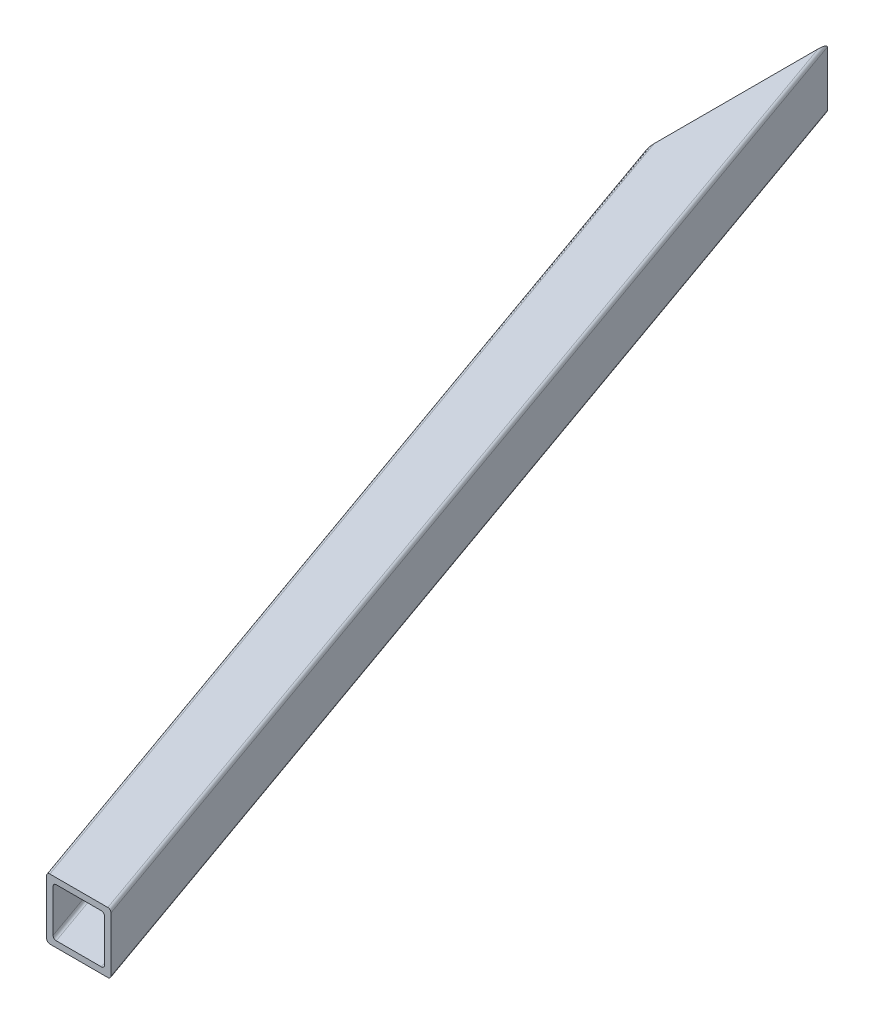
from build123d import *

# Parameters (mm, degrees)
BOSS_EXTRU_1_DEPTH           = 40
COQUE1_T                     = 4
ENL_V_MAT_EXTRU_1_DEPTH      = 833.320761278
ENL_V_MAT_EXTRU_1_DEPTH_BACK = 833.320761278
ESQUISSE2_W                  = 32
ESQUISSE2_H                  = 32
CONG_1_R                     = 2


with BuildPart() as part:
    # Esquisse1 → Boss.-Extru.1 (new body)
    with BuildSketch(Plane(origin=(0, 0, 0), x_dir=(1, 0, 0), z_dir=(0, 1, 0))):
        Polygon((0, 609.961146446), (215.575309292, 0), (258, 0), (0, 730), align=None)
    extrude(amount=BOSS_EXTRU_1_DEPTH)

    # Coque1 (no face opened: a closed hollow body)
    add(offset(amount=-COQUE1_T, mode=Mode.PRIVATE), mode=Mode.SUBTRACT)

    # Esquisse2 → Enlèv. mat.-Extru.1 (cut, two sides: drawn at the far end of the back side and taken through both)
    with BuildSketch(Plane(origin=(23.937308809, 0, 67.729594691), x_dir=(0, -1, 0), z_dir=(-0.33322544172708785, 0, -0.9428471800805194)).offset(-ENL_V_MAT_EXTRU_1_DEPTH_BACK)):
        with Locations((-20, -223.254572461)):
            Rectangle(ESQUISSE2_W, ESQUISSE2_H)
    extrude(amount=ENL_V_MAT_EXTRU_1_DEPTH + ENL_V_MAT_EXTRU_1_DEPTH_BACK, mode=Mode.SUBTRACT)

    # Congé1
    cong_1_edges = [part.edges().sort_by_distance(p)[0] for p in [
        (129, 40, -365),
        (109.908889181, 4, -310.982515901),
        (126.878765465, 4, -358.998057322),
        (109.908889181, 36, -310.982515901),
        (126.878765465, 36, -358.998057322),
        (129, 0, -365),
        (107.787654646, 0, -304.980573223),
        (107.787654646, 40, -304.980573223),
    ]]
    fillet(cong_1_edges, radius=CONG_1_R)


solid = part.part
